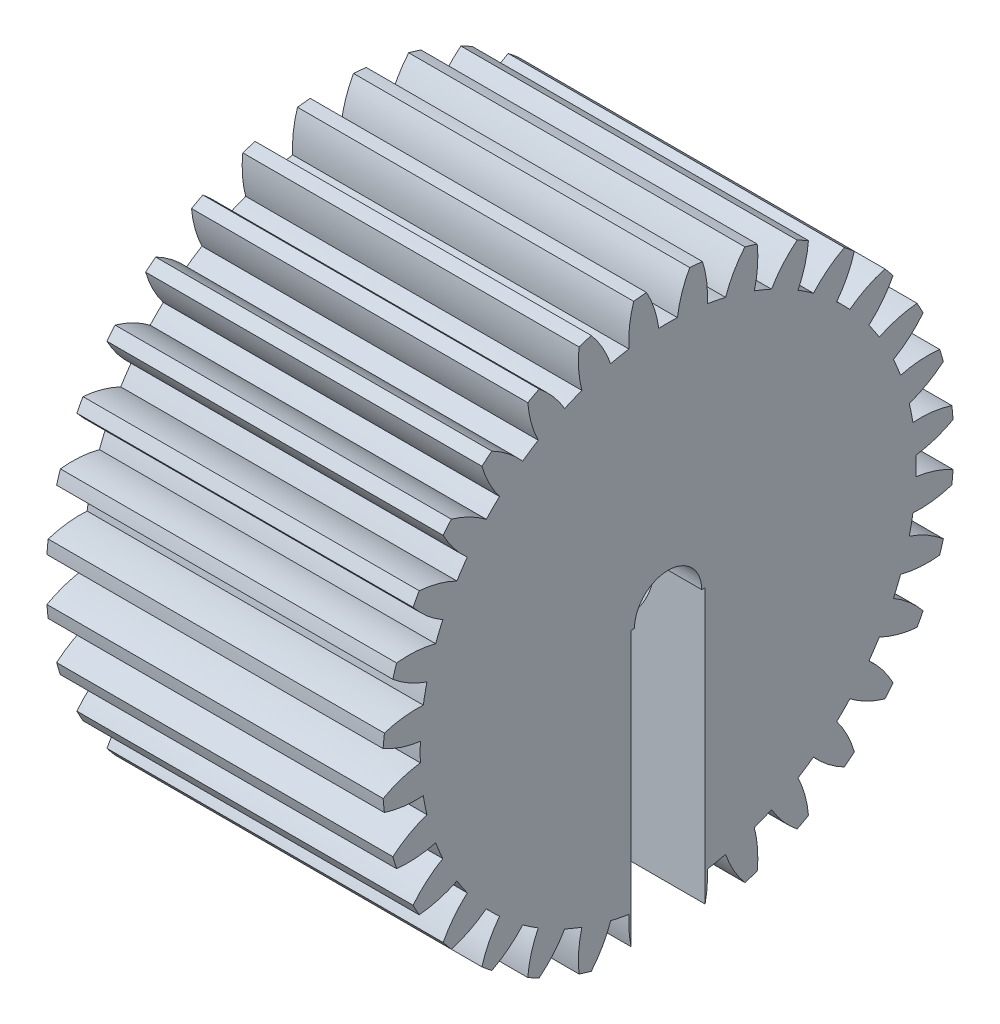
from build123d import *

# Parameters (mm, degrees)
BASPROSKE_W         = 10
BASPROSKE_H         = 8.5
TOOTHCUT_DEPTH      = 16.636495771
TEETHCUTS_COUNT     = 32
TEETHCUTS_ANGLE     = 348.75
BORSKE_R            = 1
BORE_DEPTH          = 50.0000508
SKETCH1_W           = 2.2
SKETCH1_H           = 12
CUT_EXTRUDE1_DEPTH  = 16.610070769
SKETCH4_R           = 1.125
SKETCH4_R_2         = 0.5
BOSS_EXTRUDE1_DEPTH = 0.5
BOSS_EXTRUDE2_REACH = 18.234
SKETCH5_W           = 2.5
SKETCH5_H           = 8.148803967
CUT_EXTRUDE4_START  = -2.45
SKETCH6_R           = 1.125
CUT_EXTRUDE4_DEPTH  = 2.45
SKETCH7_R           = 0.5
CUT_EXTRUDE5_DEPTH  = 2.4


with BuildPart() as part:
    # BasProSke → Base-Revolve (revolve)
    with BuildSketch(Plane(origin=(0, 0, 0), x_dir=(1, 0, 0), z_dir=(0, 1, 0)), mode=Mode.PRIVATE) as base_revolve_sk:
        with Locations((5, 4.25)):
            Rectangle(BASPROSKE_W, BASPROSKE_H)
    revolve(base_revolve_sk.sketch.rotate(Axis((-10, 0, 0), (1, 0, 0)), 180), axis=Axis((-10, 0, 0), (1, 0, 0)))

    # TooCutSke → ToothCut (cut, through all)
    with BuildSketch(Plane(origin=(0, 0, 0), x_dir=(0, 0, -1), z_dir=(1, 0, 0))):
        with BuildLine():
            ThreePointArc((0.277002447, 7.3687954), (0, 7.374), (-0.277002447, 7.3687954))
            ThreePointArc((-0.277002447, 7.3687954), (-0.41335061, 7.952280695), (-0.656086882, 8.500117362))
            ThreePointArc((-0.656086882, 8.500117362), (0, 8.5254), (0.656086882, 8.500117362))
            ThreePointArc((0.656086882, 8.500117362), (0.41335061, 7.952280695), (0.277002447, 7.3687954))
        make_face()
    toothcut = extrude(amount=TOOTHCUT_DEPTH, mode=Mode.SUBTRACT)

    # TeethCuts: ToothCut ×32 about axis
    teethcuts_axis = Axis((-10, 0, 0), (1, 0, 0))
    for i in range(1, TEETHCUTS_COUNT):
        add(toothcut.rotate(teethcuts_axis, i * TEETHCUTS_ANGLE / (TEETHCUTS_COUNT - 1)), mode=Mode.SUBTRACT)

    # BorSke → Bore (cut, symmetric)
    with BuildSketch(Plane(origin=(0, 0, 0), x_dir=(0, 0, -1), z_dir=(1, 0, 0))):
        with Locations(Location((0, 0, 0), (0, 0, 180))):
            Circle(BORSKE_R)
    extrude(amount=BORE_DEPTH, both=True, mode=Mode.SUBTRACT)

    # Sketch1 → Cut-Extrude1 (cut, through all)
    with BuildSketch(Plane(origin=(10, 0, 0), x_dir=(0, 0, -1), z_dir=(1, 0, 0))):
        with Locations((0, -6)):
            Rectangle(SKETCH1_W, SKETCH1_H)
    extrude(amount=-CUT_EXTRUDE1_DEPTH, mode=Mode.SUBTRACT)

    # Sketch2 → Cut-Revolve1 (revolve, cut)
    with BuildSketch(Plane.XY):
        with BuildLine():
            Line((3.25, 0), (8.75, 0))
            ThreePointArc((8.75, 0), (6, 2.75), (3.25, 0))
        make_face()
    revolve(axis=Axis((3.25, 0, 0), (1, 0, 0)), mode=Mode.SUBTRACT)

    # Sketch4 → Boss-Extrude1 (add)
    with BuildSketch(Plane.ZY.offset(-3)):
        Circle(SKETCH4_R)
        Circle(SKETCH4_R_2, mode=Mode.SUBTRACT)
    extrude(amount=BOSS_EXTRUDE1_DEPTH)

    # Sketch5 → Boss-Extrude2 (add, up to next)
    with BuildSketch(Plane.XY.offset(-1.1), mode=Mode.PRIVATE) as boss_extrude2_sk1:
        with Locations((1.25, -4.074401984)):
            Rectangle(SKETCH5_W, SKETCH5_H)
    boss_extrude2_tool1 = extrude(boss_extrude2_sk1.sketch, amount=BOSS_EXTRUDE2_REACH, mode=Mode.PRIVATE) - part.part
    add(boss_extrude2_tool1.solids().sort_by_distance((1.25, -4.074402, -1.1))[0])

    # Sketch6 → Cut-Extrude4 (cut)
    with BuildSketch(Plane.ZY.offset(CUT_EXTRUDE4_START)):
        Circle(SKETCH6_R)
    extrude(amount=CUT_EXTRUDE4_DEPTH, mode=Mode.SUBTRACT)

    # Sketch7 → Cut-Extrude5 (cut)
    with BuildSketch(Plane(origin=(2.5, 0, 0), x_dir=(0, 0, -1), z_dir=(1, 0, 0))):
        with Locations(Location((0, 0, 0), (0, 0, 180))):
            Circle(SKETCH7_R)
    extrude(amount=-CUT_EXTRUDE5_DEPTH, mode=Mode.SUBTRACT)


solid = part.part
